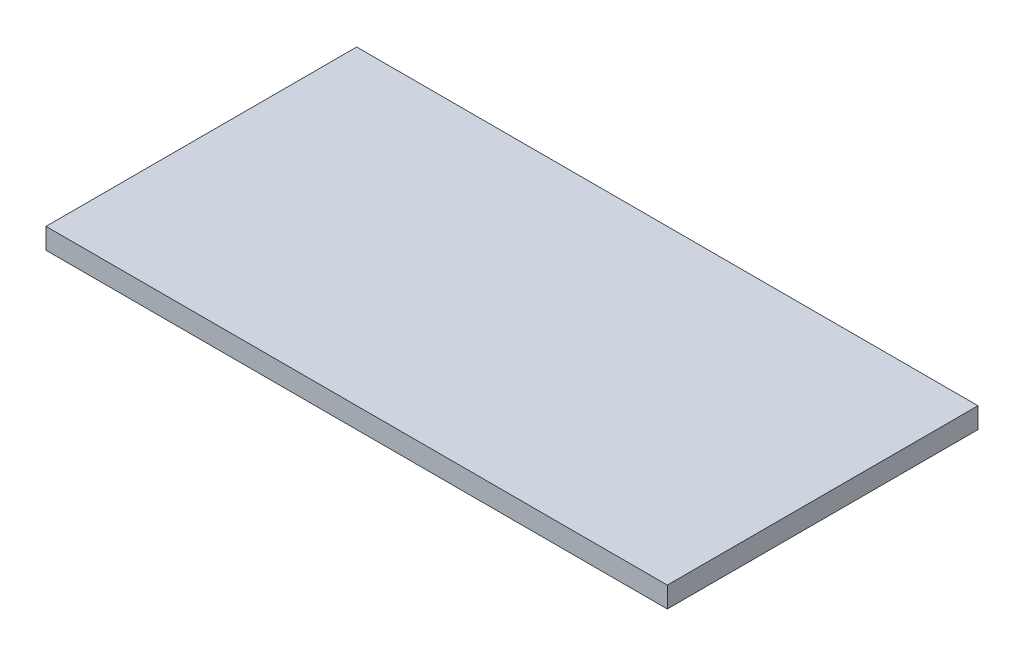
from build123d import *

# Parameters (mm, degrees)
SKETCH_1_W      = 600
SKETCH_1_H      = 300
EXTRUDE_1_DEPTH = 20


with BuildPart() as part:
    # 草图1 → 凸台-拉伸1 (new body)
    with BuildSketch(Plane(origin=(0, 0, 0), x_dir=(1, 0, 0), z_dir=(0, 1, 0))):
        Rectangle(SKETCH_1_W, SKETCH_1_H)
    extrude(amount=EXTRUDE_1_DEPTH)


solid = part.part
